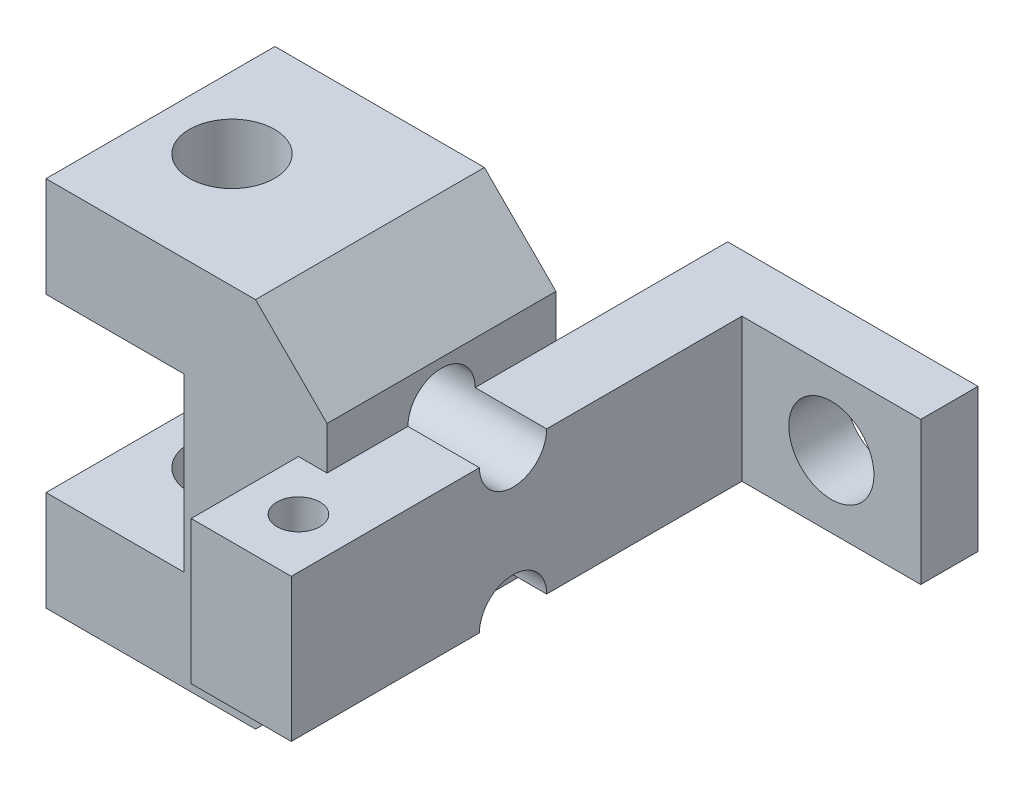
from build123d import *

# Parameters (mm, degrees)
BOSS_EXTRUDE1_DEPTH     = 4.064
SKETCH14_W              = 9.017
SKETCH14_H              = 2.54
BOSS_EXTRUDE5_DEPTH     = 1.27
SKETCH15_W              = 1.905
SKETCH15_H              = 2.54
BOSS_EXTRUDE6_DEPTH     = 0.508
SKETCH16_W              = 1.016
SKETCH16_H              = 2.54
BOSS_EXTRUDE7_DEPTH     = 3.175
SKETCH17_R              = 0.75565
CUT_EXTRUDE6_DEPTH      = 3.175
SKETCH18_R              = 0.381
CUT_EXTRUDE7_DEPTH      = 3.175
CUT_EXTRUDE9_DEPTH      = 11.204992749
CUT_EXTRUDE9_DEPTH_BACK = 2.54
SKETCH19_R              = 0.5969
SKETCH20_R              = 0.75565
CUT_EXTRUDE10_DEPTH     = 10


with BuildPart() as part:
    # Sketch1 → Boss-Extrude1 (new body)
    with BuildSketch(Plane.XY):
        Polygon((0, 0), (-2.45, 0), (-2.45, 1.778), (0, 1.778), (0, 4.826), (-2.45, 4.826), (-2.45, 6.604), (0, 6.604), (1.27, 6.604), (2.54, 5.334), (2.54, 1.27), (1.27, 0), align=None)
    extrude(amount=BOSS_EXTRUDE1_DEPTH)

    # Sketch14 → Boss-Extrude5 (add)
    with BuildSketch(Plane(origin=(2.54, 0, 0), x_dir=(0, 0, -1), z_dir=(1, 0, 0))):
        with Locations((-1.4605, 3.302)):
            Rectangle(SKETCH14_W, SKETCH14_H)
    extrude(amount=BOSS_EXTRUDE5_DEPTH)

    # Sketch15 → Boss-Extrude6 (add)
    with BuildSketch(Plane.ZY.offset(-2.54)):
        with Locations((5.0165, 3.302)):
            Rectangle(SKETCH15_W, SKETCH15_H)
    extrude(amount=BOSS_EXTRUDE6_DEPTH)

    # Sketch16 → Boss-Extrude7 (add)
    with BuildSketch(Plane(origin=(3.81, 0, 0), x_dir=(0, 0, -1), z_dir=(1, 0, 0))):
        with Locations((2.54, 3.302)):
            Rectangle(SKETCH16_W, SKETCH16_H)
    extrude(amount=BOSS_EXTRUDE7_DEPTH)

    # Sketch17 → Cut-Extrude6 (cut)
    with BuildSketch(Plane(origin=(0, 0, -3.048), x_dir=(-1, 0, 0), z_dir=(0, 0, -1))):
        with Locations((-5.3975, 3.302)):
            Circle(SKETCH17_R)
    extrude(amount=-CUT_EXTRUDE6_DEPTH, mode=Mode.SUBTRACT)

    # Sketch18 → Cut-Extrude7 (cut)
    with BuildSketch(Plane.XZ.offset(-2.032)):
        with Locations((2.921, 4.953)):
            Circle(SKETCH18_R)
    extrude(amount=-CUT_EXTRUDE7_DEPTH, mode=Mode.SUBTRACT)

    # Sketch19 → Cut-Extrude9 (cut, two sides: drawn at the far end of the back side and taken through both)
    with BuildSketch(Plane(origin=(2.54, 0, 0), x_dir=(0, 0, -1), z_dir=(1, 0, 0)).offset(-CUT_EXTRUDE9_DEPTH_BACK)):
        with Locations((-2.032, 4.572)):
            Circle(SKETCH19_R)
        with Locations(Location((-2.032, 2.032, 0), (0, 0, 334.815663466))):
            Circle(SKETCH19_R)
    extrude(amount=CUT_EXTRUDE9_DEPTH + CUT_EXTRUDE9_DEPTH_BACK, mode=Mode.SUBTRACT)

    # Sketch20 → Cut-Extrude10 (cut)
    with BuildSketch(Plane(origin=(0, 6.604, 0), x_dir=(1, 0, 0), z_dir=(0, 1, 0))):
        with Locations(Location((-1.18, -2.032, 0), (0, 0, 180))):
            Circle(SKETCH20_R)
    extrude(amount=-CUT_EXTRUDE10_DEPTH, mode=Mode.SUBTRACT)


solid = part.part
